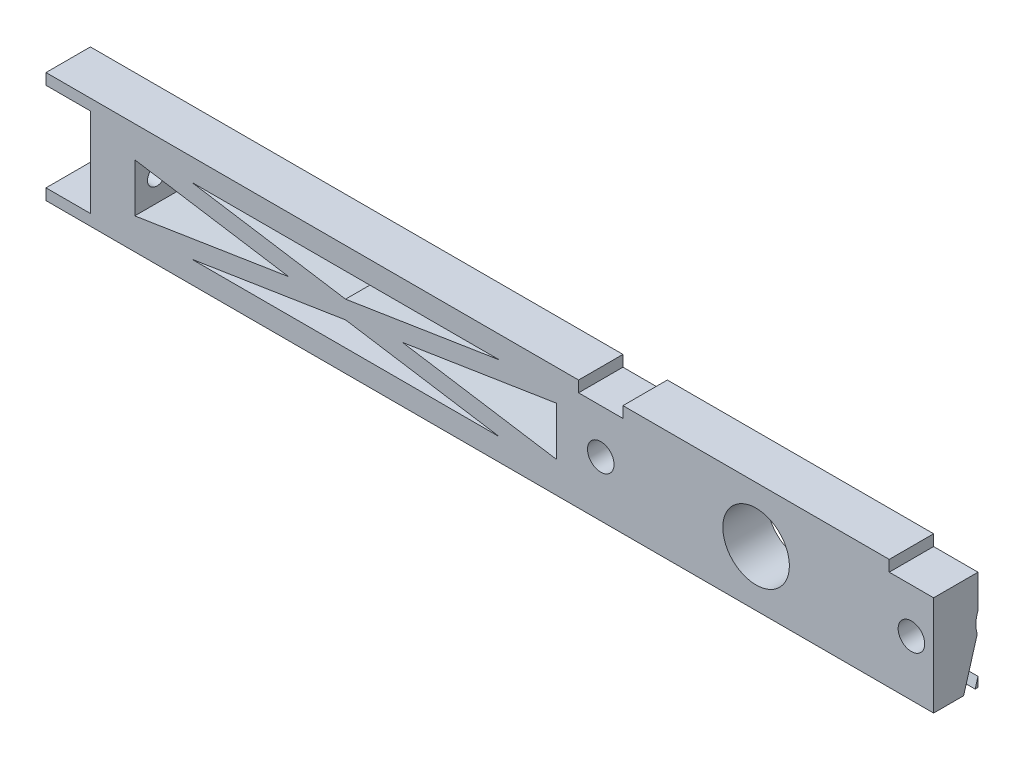
from build123d import *

# Parameters (mm, degrees)
SKETCH1_W                                         = 127
SKETCH1_H                                         = 15.875
SKETCH1_R                                         = 4.7625
BOSS_EXTRUDE1_DEPTH                               = 6.35
CSK_FOR_6_FLAT_HEAD_MACHINE_SCREW_100_D           = 3.7973
CSK_FOR_6_FLAT_HEAD_MACHINE_SCREW_100_CSINK_D     = 7.0866
CSK_FOR_6_FLAT_HEAD_MACHINE_SCREW_100_CSINK_ANGLE = 100
SKETCH5_W                                         = 6.35
SKETCH5_H                                         = 12.7
CUT_EXTRUDE1_DEPTH                                = 103.107229941
SKETCH6_W                                         = 6.35
SKETCH6_H                                         = 1.5875
CUT_EXTRUDE2_DEPTH                                = 103.107229941
TAP_DRILL_FOR_6_32_TAP1_D                         = 2.7051
TAP_DRILL_FOR_6_32_TAP1_DEPTH                     = 6.35
TAP_DRILL_FOR_6_32_TAP1_TIP                       = 0.81269403


with BuildPart() as part:
    # Sketch1 → Boss-Extrude1 (new body)
    with BuildSketch(Plane.XY):
        with Locations((-38.1, 0)):
            Rectangle(SKETCH1_W, SKETCH1_H)
        Polygon((-88.9, 3.476766434), (-66.880479253, 0), (-88.9, -3.476766434), align=None, mode=Mode.SUBTRACT)
        Polygon((-80.757020747, -4.7625), (-58.7375, -1.285733566), (-36.717979253, -4.7625), align=None, mode=Mode.SUBTRACT)
        Polygon((-28.575, -3.476766434), (-50.594520747, 0), (-28.575, 3.476766434), align=None, mode=Mode.SUBTRACT)
        Polygon((-36.717979253, 4.7625), (-58.7375, 1.285733566), (-80.757020747, 4.7625), align=None, mode=Mode.SUBTRACT)
        Circle(SKETCH1_R, mode=Mode.SUBTRACT)
    extrude(amount=BOSS_EXTRUDE1_DEPTH)

    # CSK for #6 Flat Head Machine Screw (100)1 (through all)
    with Locations(Plane(origin=(0, 0, 0), x_dir=(-1, 0, 0), z_dir=(0, 0, -1))):
        with Locations((-22.225, 0), (22.225, 0)):
            CounterSinkHole(CSK_FOR_6_FLAT_HEAD_MACHINE_SCREW_100_D / 2, CSK_FOR_6_FLAT_HEAD_MACHINE_SCREW_100_CSINK_D / 2, counter_sink_angle=CSK_FOR_6_FLAT_HEAD_MACHINE_SCREW_100_CSINK_ANGLE)

    # Sketch5 → Cut-Extrude1 (cut, through all)
    with BuildSketch(Plane(origin=(0, 0, 0), x_dir=(-1, 0, 0), z_dir=(0, 0, -1))):
        with Locations((98.425, 0)):
            Rectangle(SKETCH5_W, SKETCH5_H)
    extrude(amount=-CUT_EXTRUDE1_DEPTH, mode=Mode.SUBTRACT)

    # Sketch6 → Cut-Extrude2 (cut, through all)
    with BuildSketch(Plane(origin=(0, 0, 0), x_dir=(-1, 0, 0), z_dir=(0, 0, -1))):
        with Locations((22.225, 7.14375)):
            Rectangle(SKETCH6_W, SKETCH6_H)
        with Locations((-22.225, 7.14375)):
            Rectangle(SKETCH6_W, SKETCH6_H)
    cut_extrude2 = extrude(amount=-CUT_EXTRUDE2_DEPTH, mode=Mode.SUBTRACT)

    # Mirror3: Cut-Extrude2 across plane
    add(cut_extrude2.mirror(Plane(origin=(0, 3.046697428, 2.281546151), x_dir=(0, -0.5994152204724752, 0.8004382508763147), z_dir=(0, -0.8004382508763147, -0.5994152204724751))), mode=Mode.SUBTRACT)

    # Tap Drill for #6-32 Tap1
    with Locations(Plane.ZY.offset(95.25)):
        with Locations((3.175, 0)):
            Hole(TAP_DRILL_FOR_6_32_TAP1_D / 2, depth=TAP_DRILL_FOR_6_32_TAP1_DEPTH)
            with Locations((0, 0, -(TAP_DRILL_FOR_6_32_TAP1_DEPTH + TAP_DRILL_FOR_6_32_TAP1_TIP / 2))):  # 118° drill point
                Cone(0, TAP_DRILL_FOR_6_32_TAP1_D / 2, TAP_DRILL_FOR_6_32_TAP1_TIP, mode=Mode.SUBTRACT)


solid = part.part
